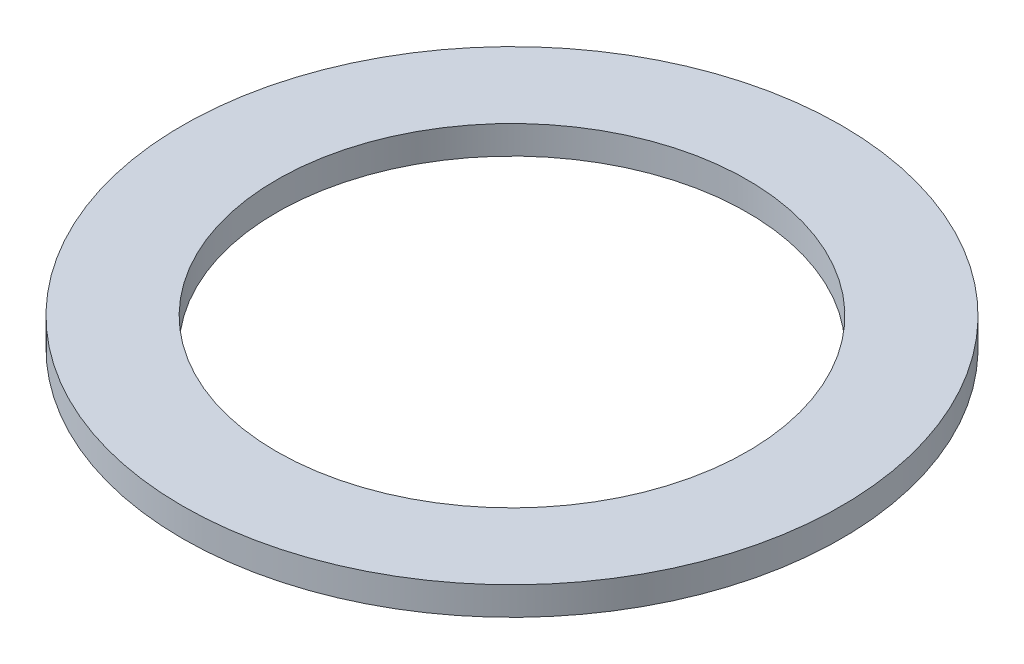
from build123d import *

# Parameters (mm, degrees)
SKETCH1_R           = 3.5
SKETCH1_R_2         = 2.5
BOSS_EXTRUDE1_DEPTH = 0.3


with BuildPart() as part:
    # Sketch1 → Boss-Extrude1 (new body)
    with BuildSketch(Plane(origin=(0, 0, 0), x_dir=(1, 0, 0), z_dir=(0, 1, 0))):
        with Locations(Location((0, 0, 0), (0, 0, 270))):
            Circle(SKETCH1_R)
        with Locations(Location((0, 0, 0), (0, 0, 270))):
            Circle(SKETCH1_R_2, mode=Mode.SUBTRACT)
    extrude(amount=BOSS_EXTRUDE1_DEPTH)


solid = part.part
